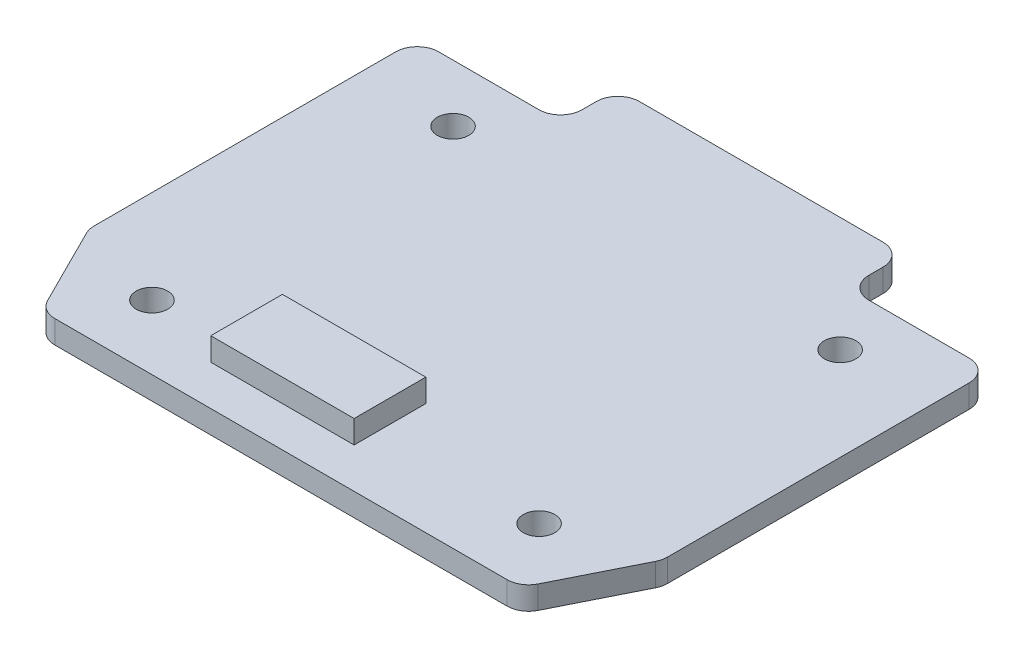
from build123d import *

# Parameters (mm, degrees)
BOSS_EXTRUDE1_DEPTH      = 1.6
CUT_EXTRUDE4_DEPTH       = 28.461290938
M2_CLEARANCE_HOLE1_D     = 2.2
M2_CLEARANCE_HOLE1_DEPTH = 5.2
M2_CLEARANCE_HOLE1_TIP   = 0.660946681
SKETCH11_W               = 30
SKETCH11_H               = 28.944863729
SKETCH11_R               = 1
CUT_EXTRUDE3_DEPTH       = 0.001
SKETCH13_W               = 10
SKETCH13_H               = 5
BOSS_EXTRUDE2_DEPTH      = 1.6
FILLET1_R                = 1.5


with BuildPart() as part:
    # Sketch1 → Boss-Extrude1 (new body)
    with BuildSketch(Plane(origin=(0, 0, 0), x_dir=(1, 0, 0), z_dir=(0, 1, 0))):
        Polygon((-20, 14.75), (-10, 14.75), (-10, 18.75), (10, 18.75), (10, 14.75), (20, 14.75), (20, -14.75), (-20, -14.75), align=None)
    extrude(amount=BOSS_EXTRUDE1_DEPTH)

    # Sketch12 → Cut-Extrude4 (cut, through all)
    with BuildSketch(Plane(origin=(0, 1.6, 0), x_dir=(1, 0, 0), z_dir=(0, 1, 0))):
        Polygon((-16.7, -14.75), (-20, -8.15), (-20, -14.75), align=None)
        Polygon((16.7, -14.75), (20, -8.15), (20, -14.75), align=None)
    extrude(amount=-CUT_EXTRUDE4_DEPTH, mode=Mode.SUBTRACT)

    # M2 Clearance Hole1
    with Locations(Plane(origin=(0, 1.6, 0), x_dir=(1, 0, 0), z_dir=(0, 1, 0))):
        with Locations((-13.5, 10.75), (13.5, 10.75), (13.5, -10.25), (-13.5, -10.25)):
            Hole(M2_CLEARANCE_HOLE1_D / 2, depth=M2_CLEARANCE_HOLE1_DEPTH)
            with Locations((0, 0, -(M2_CLEARANCE_HOLE1_DEPTH + M2_CLEARANCE_HOLE1_TIP / 2))):  # 118° drill point
                Cone(0, M2_CLEARANCE_HOLE1_D / 2, M2_CLEARANCE_HOLE1_TIP, mode=Mode.SUBTRACT)

    # Sketch11 → Cut-Extrude3 (cut)
    with BuildSketch(Plane.XZ):
        with Locations((0, -0.277568136)):
            Rectangle(SKETCH11_W, SKETCH11_H)
        with Locations((13.5, -12.75)):
            Circle(SKETCH11_R, mode=Mode.SUBTRACT)
        with Locations((13.5, 10.25)):
            Circle(SKETCH11_R, mode=Mode.SUBTRACT)
        with Locations((-13.5, -12.75)):
            Circle(SKETCH11_R, mode=Mode.SUBTRACT)
        with Locations((-13.5, 10.25)):
            Circle(SKETCH11_R, mode=Mode.SUBTRACT)
        with BuildLine():
            Line((-10, 11.694863729), (10, 11.694863729))
            ThreePointArc((10, 11.694863729), (11.434632325, 11.088706998), (12, 9.637516011))
            Line((12, 9.637516011), (12, -9.74800182))
            add(Edge.make_bspline(
                [(10, -11.748801092), (12, -11.748801092), (12, -9.74800182)],
                knots=[3.141592654, 3.141592654, 3.141592654, 4.71238898, 4.71238898, 4.71238898], degree=2, weights=[1, 0.707106781, 1]))
            Line((10, -11.748801092), (-10, -11.748801092))
            add(Edge.make_bspline(
                [(-12, -9.74800182), (-12, -11.748801092), (-10, -11.748801092)],
                knots=[1.570796327, 1.570796327, 1.570796327, 3.141592654, 3.141592654, 3.141592654], degree=2, weights=[1, 0.707106781, 1]))
            Line((-12, -9.74800182), (-12, 9.750612903))
            ThreePointArc((-12, 9.750612903), (-11.394642541, 11.128696782), (-10, 11.694863729))
        make_face(mode=Mode.SUBTRACT)
    extrude(amount=-CUT_EXTRUDE3_DEPTH, mode=Mode.SUBTRACT)

    # Fillet1
    fillet1_edges = [part.edges().sort_by_distance(p)[0] for p in [
        (-20, 0.8, -14.75),
        (-10, 0.8005, -14.75),
        (-10, 0.8, -18.75),
        (10, 0.8, -18.75),
        (10, 0.8005, -14.75),
        (20, 0.8, -14.75),
        (-16.7, 0.8, 14.75),
        (-20, 0.8, 8.15),
        (16.7, 0.8, 14.75),
        (20, 0.8, 8.15),
    ]]
    fillet(fillet1_edges, radius=FILLET1_R)


with BuildPart() as body_2:
    # Sketch13 → Boss-Extrude2 (new body)
    with BuildSketch(Plane(origin=(0, 1.6, 0), x_dir=(1, 0, 0), z_dir=(0, 1, 0))):
        with Locations((-2.7, -9.45)):
            Rectangle(SKETCH13_W, SKETCH13_H)
    extrude(amount=BOSS_EXTRUDE2_DEPTH)


solid = Compound([part.part, body_2.part])
